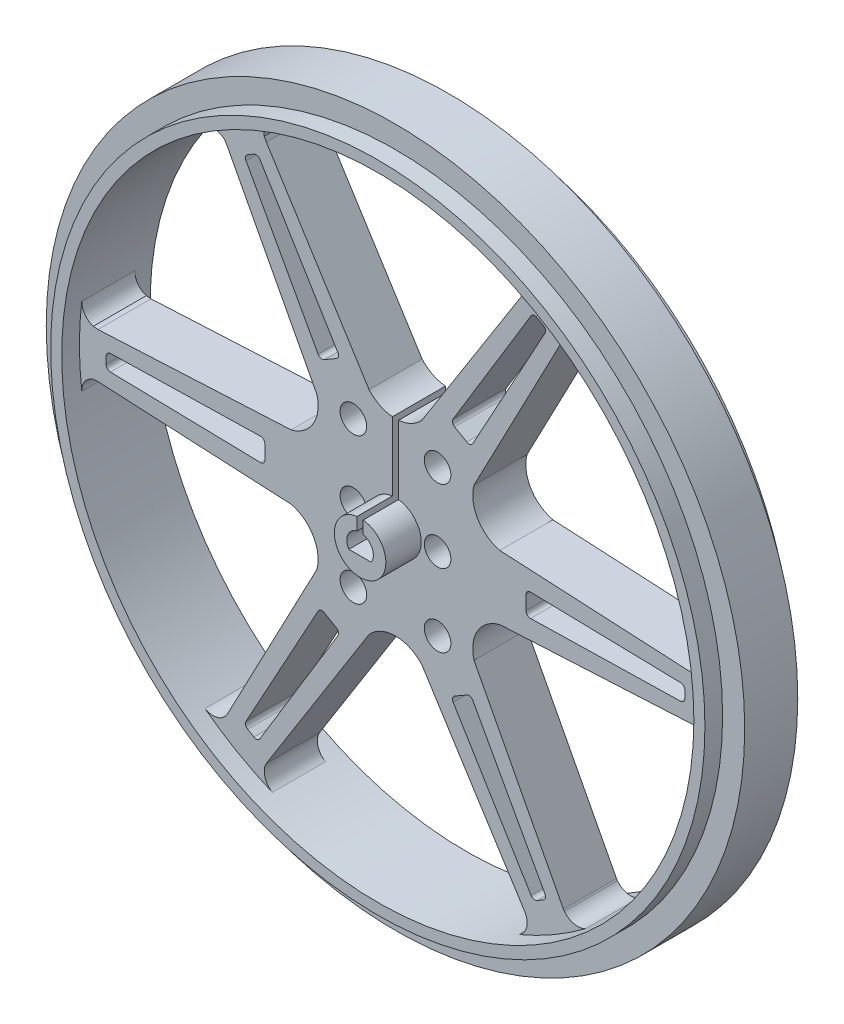
from build123d import *

# Parameters (mm, degrees)
Y_KSEKLIK_EKSTR_ZYON5_DEPTH      = 5
Y_KSEKLIK_EKSTR_ZYON5_DEPTH_BACK = 5
IZIM1_R                          = 37
IZIM1_R_2                        = 35.75
Y_KSEKLIK_EKSTR_ZYON6_DEPTH      = 3
Y_KSEKLIK_EKSTR_ZYON6_DEPTH_BACK = 3
IZIM1_13_R                       = 39.5
IZIM1_13_R_2                     = 37
Y_KSEKLIK_EKSTR_ZYON7_DEPTH      = 3
Y_KSEKLIK_EKSTR_ZYON7_DEPTH_BACK = 3
IZIM1_14_R                       = 1.5
Y_KSEKLIK_EKSTR_ZYON8_DEPTH      = 7
Y_KSEKLIK_EKSTR_ZYON8_DEPTH_BACK = 3


with BuildPart() as part:
    # Çizim1 → Yükseklik-Ekstrüzyon5 (new, two sides: drawn at the far end of the back side and taken through both)
    with BuildSketch(Plane.XY.offset(-Y_KSEKLIK_EKSTR_ZYON5_DEPTH_BACK)):
        Circle(IZIM1_R)
        Circle(IZIM1_R_2, mode=Mode.SUBTRACT)
    extrude(amount=Y_KSEKLIK_EKSTR_ZYON5_DEPTH + Y_KSEKLIK_EKSTR_ZYON5_DEPTH_BACK)

    # Çizim1<13> → Yükseklik-Ekstrüzyon6 (add, two sides: drawn at the far end of the back side and taken through both)
    with BuildSketch(Plane.XY.offset(-Y_KSEKLIK_EKSTR_ZYON6_DEPTH_BACK)):
        Circle(IZIM1_13_R)
        Circle(IZIM1_13_R_2, mode=Mode.SUBTRACT)
    extrude(amount=Y_KSEKLIK_EKSTR_ZYON6_DEPTH + Y_KSEKLIK_EKSTR_ZYON6_DEPTH_BACK)

    # Çizim1<14> → Yükseklik-Ekstrüzyon7 (add, two sides: drawn at the far end of the back side and taken through both)
    with BuildSketch(Plane.XY.offset(-Y_KSEKLIK_EKSTR_ZYON7_DEPTH_BACK)):
        with BuildLine():
            Line((0.352105211, 10.658426892), (0.352105211, 8.25))
            Line((0.352105211, 8.25), (0.352105211, 2.891667151))
            ThreePointArc((0.352105211, 2.891667151), (2.180757714, 1.931324101), (2.913025402, 0))
            ThreePointArc((2.913025402, 0), (-1.931880518, -2.180264813), (-0.350629391, 2.891846473))
            Line((-0.350629391, 2.891846473), (-0.347894744, 8.250178624))
            Line((-0.347894744, 8.250178624), (-0.346665593, 10.658605202))
            ThreePointArc((-0.346665593, 10.658605202), (-1.792646187, 11.069293289), (-2.984941087, 11.98469345))
            Line((-2.984941087, 11.98469345), (-14.607887345, 30.4259885))
            Line((-14.607887345, 30.4259885), (-14.847868654, 30.886461313))
            ThreePointArc((-14.847868654, 30.886461313), (-14.727142284, 32.060689053), (-13.92488883, 32.926584565))
            ThreePointArc((-13.92488883, 32.926584565), (-17.875, 30.960408185), (-21.552814278, 28.522599754))
            ThreePointArc((-21.552814278, 28.522599754), (-20.401800041, 28.78442387), (-19.324525803, 28.301862102))
            Line((-19.324525803, 28.301862102), (-19.045735303, 27.863795787))
            Line((-19.045735303, 27.863795787), (-8.886868167, 8.577081355))
            ThreePointArc((-8.886868167, 8.577081355), (-9.303777514, 5.496482546), (-11.800782256, 3.644761794))
            Line((-11.800782256, 3.644761794), (-33.653555768, 2.549643924))
            Line((-33.653555768, 2.549643924), (-34.19029782, 2.590308308))
            ThreePointArc((-34.19029782, 2.590308308), (-35.134400226, 3.283913251), (-35.477703108, 4.403984811))
            ThreePointArc((-35.477703108, 4.403984811), (-35.75, 0), (-35.477703108, -4.403984811))
            ThreePointArc((-35.477703108, -4.403984811), (-35.134400226, -3.283913251), (-34.19029782, -2.590308308))
            Line((-34.19029782, -2.590308308), (-33.653555768, -2.549643924))
            Line((-33.653555768, -2.549643924), (-11.802585687, -3.638917628))
            ThreePointArc((-11.802585687, -3.638917628), (-9.303458853, -5.492132995), (-8.888309481, -8.575587733))
            Line((-8.888309481, -8.575587733), (-19.045735303, -27.863795787))
            ThreePointArc((-19.045735303, -27.863795787), (-20.165883221, -28.700819486), (-21.552814278, -28.522599754))
            ThreePointArc((-21.552814278, -28.522599754), (-17.875, -30.960408185), (-13.92488883, -32.926584565))
            ThreePointArc((-13.92488883, -32.926584565), (-14.772697173, -31.814576902), (-14.607887345, -30.4259885))
            Line((-14.607887345, -30.4259885), (-2.984941087, -11.98469345))
            ThreePointArc((-2.984941087, -11.98469345), (0.002715908, -10.643228062), (2.991057136, -11.983168513))
            Line((2.991057136, -11.983168513), (14.663708375, -30.397995932))
            ThreePointArc((14.663708375, -30.397995932), (14.817986455, -31.815304786), (13.92488883, -32.926584565))
            ThreePointArc((13.92488883, -32.926584565), (17.875, -30.960408185), (21.552814278, -28.522599754))
            ThreePointArc((21.552814278, -28.522599754), (20.242255546, -28.76161283), (19.107217792, -28.064202809))
            Line((19.107217792, -28.064202809), (18.993975038, -27.89787469))
            Line((18.993975038, -27.89787469), (8.881942007, -8.582182507))
            ThreePointArc((8.881942007, -8.582182507), (9.294710999, -5.488602486), (11.804336715, -3.633233425))
            Line((11.804336715, -3.633233425), (33.657290889, -2.499854))
            Line((33.657290889, -2.499854), (33.849149755, -2.514104082))
            ThreePointArc((33.849149755, -2.514104082), (35.026532395, -3.146147751), (35.477703108, -4.403984811))
            ThreePointArc((35.477703108, -4.403984811), (35.681860841, -2.206197397), (35.75, 0))
            ThreePointArc((35.75, 0), (35.681860841, 2.206197397), (35.477703108, 4.403984811))
            ThreePointArc((35.477703108, 4.403984811), (35.026532395, 3.146147751), (33.849149755, 2.514104082))
            Line((33.849149755, 2.514104082), (33.657290889, 2.499854))
            Line((33.657290889, 2.499854), (11.803877394, 3.634725418))
            ThreePointArc((11.803877394, 3.634725418), (9.295867667, 5.489285508), (8.88302669, 8.581059795))
            Line((8.88302669, 8.581059795), (18.993975038, 27.89787469))
            Line((18.993975038, 27.89787469), (18.993582514, 27.898141932))
            ThreePointArc((18.993582514, 27.898141932), (20.143868947, 28.740405096), (21.552814278, 28.522599754))
            ThreePointArc((21.552814278, 28.522599754), (17.875, 30.960408185), (13.92488883, 32.926584565))
            ThreePointArc((13.92488883, 32.926584565), (14.817986455, 31.815304786), (14.663708375, 30.397995932))
            Line((14.663708375, 30.397995932), (14.663280674, 30.398202247))
            Line((14.663280674, 30.398202247), (2.991057136, 11.983168513))
            ThreePointArc((2.991057136, 11.983168513), (1.798295213, 11.068376963), (0.352105211, 10.658426892))
        make_face()
        with BuildLine():
            ThreePointArc((-15.330091906, -28.374268836), (-15.633406502, -28.599064993), (-16.007432074, -28.547704226))
            Line((-16.007432074, -28.547704226), (-16.719321042, -28.136694938))
            ThreePointArc((-16.719321042, -28.136694938), (-16.950813558, -27.838459675), (-16.907791673, -27.46338345))
            Line((-16.907791673, -27.46338345), (-8.752791972, -12.583042517))
            ThreePointArc((-8.752791972, -12.583042517), (-8.44909878, -12.341848787), (-8.064321341, -12.3903286))
            Line((-8.064321341, -12.3903286), (-6.698178659, -13.179071446))
            ThreePointArc((-6.698178659, -13.179071446), (-6.463805189, -13.488058576), (-6.52083849, -13.87166146))
            Line((-6.52083849, -13.87166146), (-15.330091906, -28.374268836))
        make_face(mode=Mode.SUBTRACT)
        with Locations((-4.7625, -8.25)):
            Circle(IZIM1_14_R, mode=Mode.SUBTRACT)
        with BuildLine():
            Line((16.719321042, -28.136694938), (16.007432074, -28.547704226))
            ThreePointArc((16.007432074, -28.547704226), (15.633406502, -28.599064993), (15.330091906, -28.374268836))
            Line((15.330091906, -28.374268836), (6.52083849, -13.87166146))
            ThreePointArc((6.52083849, -13.87166146), (6.463805189, -13.488058576), (6.698178659, -13.179071446))
            Line((6.698178659, -13.179071446), (8.064321341, -12.3903286))
            ThreePointArc((8.064321341, -12.3903286), (8.44909878, -12.341848787), (8.752791972, -12.583042517))
            Line((8.752791972, -12.583042517), (16.907791673, -27.46338345))
            ThreePointArc((16.907791673, -27.46338345), (16.950813558, -27.838459675), (16.719321042, -28.136694938))
        make_face(mode=Mode.SUBTRACT)
        with Locations((4.7625, -8.25)):
            Circle(IZIM1_14_R, mode=Mode.SUBTRACT)
        with BuildLine():
            Line((-32.726753116, -0.411009288), (-32.726753116, 0.411009288))
            ThreePointArc((-32.726753116, 0.411009288), (-32.584220059, 0.760605318), (-32.237883578, 0.910885385))
            Line((-32.237883578, 0.910885385), (-15.273630462, 1.288618943))
            ThreePointArc((-15.273630462, 1.288618943), (-14.91290397, 1.146209789), (-14.7625, 0.788742846))
            Line((-14.7625, 0.788742846), (-14.7625, -0.788742846))
            ThreePointArc((-14.7625, -0.788742846), (-14.91290397, -1.146209789), (-15.273630462, -1.288618943))
            Line((-15.273630462, -1.288618943), (-32.237883578, -0.910885385))
            ThreePointArc((-32.237883578, -0.910885385), (-32.584220059, -0.760605318), (-32.726753116, -0.411009288))
        make_face(mode=Mode.SUBTRACT)
        with Locations((-4.7625, 0)):
            Circle(IZIM1_14_R, mode=Mode.SUBTRACT)
        with Locations((-4.7625, 8.25)):
            Circle(IZIM1_14_R, mode=Mode.SUBTRACT)
        with BuildLine():
            ThreePointArc((-6.52083849, 13.87166146), (-6.463805189, 13.488058576), (-6.698178659, 13.179071446))
            Line((-6.698178659, 13.179071446), (-8.064321341, 12.3903286))
            ThreePointArc((-8.064321341, 12.3903286), (-8.44909878, 12.341848787), (-8.752791972, 12.583042517))
            Line((-8.752791972, 12.583042517), (-16.907791673, 27.46338345))
            ThreePointArc((-16.907791673, 27.46338345), (-16.950813558, 27.838459675), (-16.719321042, 28.136694938))
            Line((-16.719321042, 28.136694938), (-16.007432074, 28.547704226))
            ThreePointArc((-16.007432074, 28.547704226), (-15.633406502, 28.599064993), (-15.330091906, 28.374268836))
            Line((-15.330091906, 28.374268836), (-6.52083849, 13.87166146))
        make_face(mode=Mode.SUBTRACT)
        with Locations((4.7625, 0)):
            Circle(IZIM1_14_R, mode=Mode.SUBTRACT)
        with Locations((4.7625, 8.25)):
            Circle(IZIM1_14_R, mode=Mode.SUBTRACT)
        with BuildLine():
            ThreePointArc((32.237883578, 0.910885385), (32.584220059, 0.760605318), (32.726753116, 0.411009288))
            Line((32.726753116, 0.411009288), (32.726753116, -0.411009288))
            ThreePointArc((32.726753116, -0.411009288), (32.584220059, -0.760605318), (32.237883578, -0.910885385))
            Line((32.237883578, -0.910885385), (15.273630462, -1.288618943))
            ThreePointArc((15.273630462, -1.288618943), (14.91290397, -1.146209789), (14.7625, -0.788742846))
            Line((14.7625, -0.788742846), (14.7625, 0.788742846))
            ThreePointArc((14.7625, 0.788742846), (14.91290397, 1.146209789), (15.273630462, 1.288618943))
            Line((15.273630462, 1.288618943), (32.237883578, 0.910885385))
        make_face(mode=Mode.SUBTRACT)
        with BuildLine():
            Line((8.064321341, 12.3903286), (6.698178659, 13.179071446))
            ThreePointArc((6.698178659, 13.179071446), (6.463805189, 13.488058576), (6.52083849, 13.87166146))
            Line((6.52083849, 13.87166146), (15.330091906, 28.374268836))
            ThreePointArc((15.330091906, 28.374268836), (15.633406502, 28.599064993), (16.007432074, 28.547704226))
            Line((16.007432074, 28.547704226), (16.719321042, 28.136694938))
            ThreePointArc((16.719321042, 28.136694938), (16.950813558, 27.838459675), (16.907791673, 27.46338345))
            Line((16.907791673, 27.46338345), (8.752791972, 12.583042517))
            ThreePointArc((8.752791972, 12.583042517), (8.44909878, 12.341848787), (8.064321341, 12.3903286))
        make_face(mode=Mode.SUBTRACT)
    extrude(amount=Y_KSEKLIK_EKSTR_ZYON7_DEPTH + Y_KSEKLIK_EKSTR_ZYON7_DEPTH_BACK)

    # Çizim1<17> → Yükseklik-Ekstrüzyon8 (add, two sides: drawn at the far end of the back side and taken through both)
    with BuildSketch(Plane.XY.offset(-Y_KSEKLIK_EKSTR_ZYON8_DEPTH_BACK)):
        with BuildLine():
            ThreePointArc((2.913025402, 0), (2.180757714, 1.931324101), (0.352105211, 2.891667151))
            Line((0.352105211, 2.891667151), (0.352105211, 1.458088447))
            ThreePointArc((0.352105211, 1.458088447), (1.387985779, 0.568766629), (1.274033112, -0.791732044))
            Line((1.274033112, -0.791732044), (-1.274033112, -0.791732044))
            ThreePointArc((-1.274033112, -0.791732044), (-1.387840597, 0.569120792), (-0.351361024, 1.458267956))
            Line((-0.351361024, 1.458267956), (-0.350629391, 2.891846473))
            ThreePointArc((-0.350629391, 2.891846473), (-1.931880518, -2.180264813), (2.913025402, 0))
        make_face()
    extrude(amount=Y_KSEKLIK_EKSTR_ZYON8_DEPTH + Y_KSEKLIK_EKSTR_ZYON8_DEPTH_BACK)


solid = part.part
